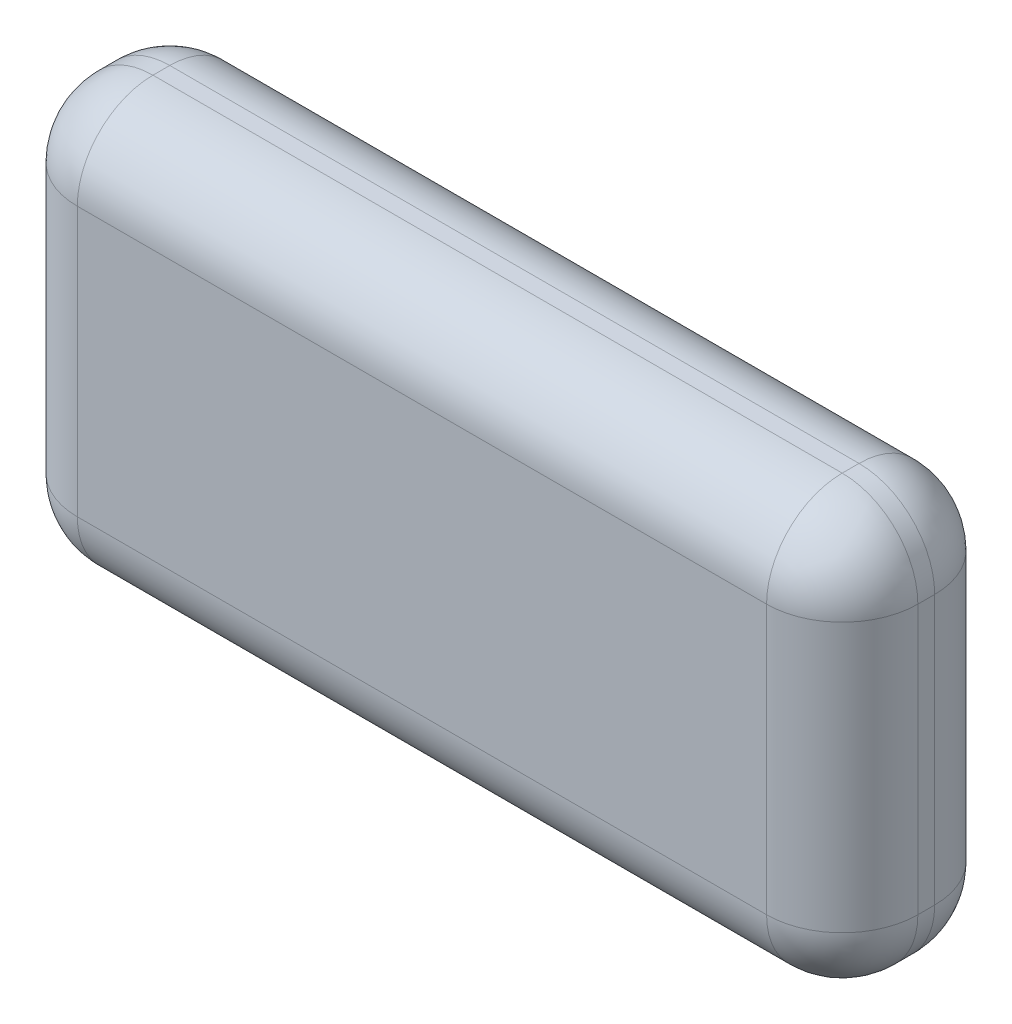
from build123d import *

# Parameters (mm, degrees)
SKETCH1_W           = 500
SKETCH1_H           = 250
BOSS_EXTRUDE1_DEPTH = 100
FILLET1_R           = 45


with BuildPart() as part:
    # Sketch1 → Boss-Extrude1 (new body)
    with BuildSketch(Plane.XY):
        with Locations((228.589263421, 109.893882647)):
            Rectangle(SKETCH1_W, SKETCH1_H)
    extrude(amount=BOSS_EXTRUDE1_DEPTH)

    # Fillet1
    fillet1_edges = [part.edges().sort_by_distance(p)[0] for p in [
        (478.589263421, 109.893882647, 100),
        (228.589263421, 234.893882647, 100),
        (-21.410736579, 109.893882647, 100),
        (228.589263421, 234.893882647, 0),
        (478.589263421, 109.893882647, 0),
        (228.589263421, -15.106117353, 0),
        (-21.410736579, 109.893882647, 0),
        (-21.410736579, 234.893882647, 50),
        (478.589263421, 234.893882647, 50),
        (478.589263421, -15.106117353, 50),
        (-21.410736579, -15.106117353, 50),
        (228.589263421, -15.106117353, 100),
    ]]
    fillet(fillet1_edges, radius=FILLET1_R)


solid = part.part
